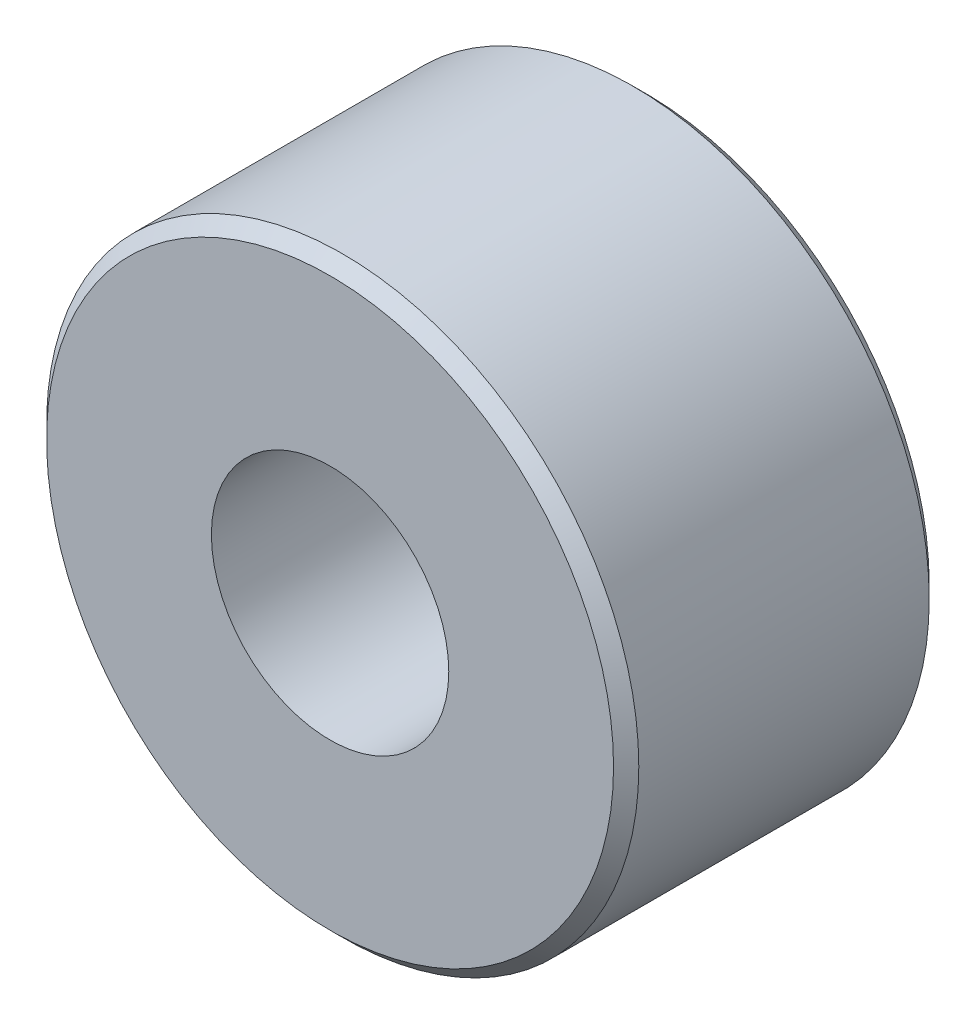
from build123d import *

# Parameters (mm, degrees)
SKETCH1_R      = 5.9563
EXTRUDE1_DEPTH = 3.175
SKETCH2_R      = 2.3876
EXTRUDE2_DEPTH = 11.548816018
CHAMFER1_SIZE  = 0.254


with BuildPart() as part:
    # Sketch1 → Extrude1 (new, symmetric)
    with BuildSketch(Plane.XY):
        Circle(SKETCH1_R)
    extrude(amount=EXTRUDE1_DEPTH, both=True)

    # Sketch2 → Extrude2 (cut, through all)
    with BuildSketch(Plane.XY.offset(3.175)):
        Circle(SKETCH2_R)
    extrude(amount=-EXTRUDE2_DEPTH, mode=Mode.SUBTRACT)

    # Chamfer1
    chamfer1_edges = [part.edges().sort_by_distance(p)[0] for p in [
        (-5.9563, 0, -3.175),
        (-5.9563, 0, 3.175),
    ]]
    chamfer(chamfer1_edges, length=CHAMFER1_SIZE)


solid = part.part
